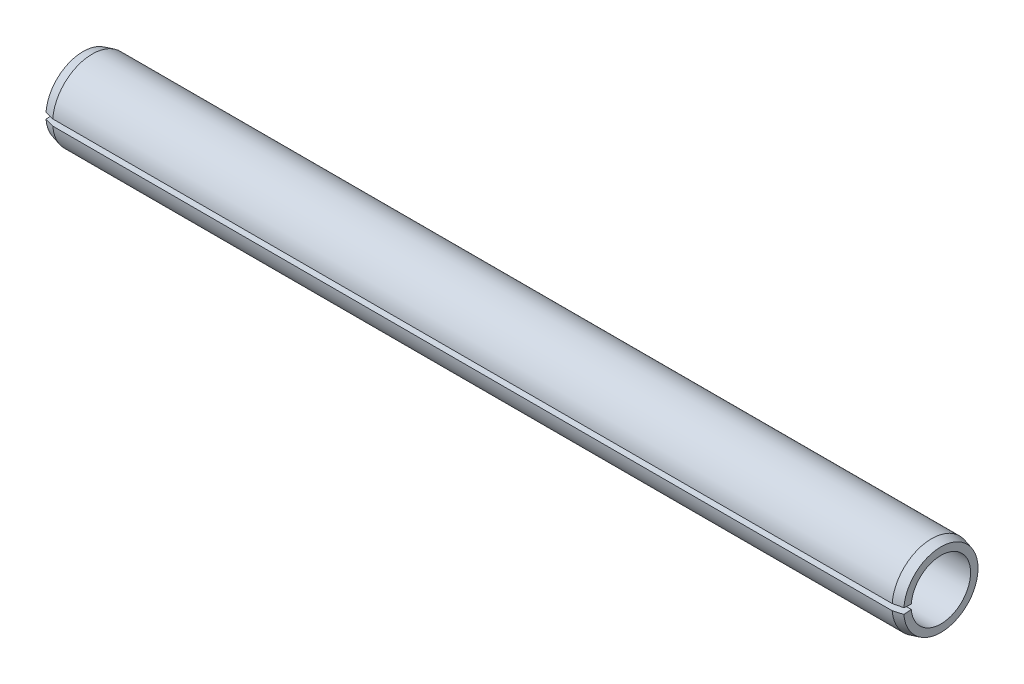
from build123d import *

# Parameters (mm, degrees)
GAP_DEPTH = 66.138314378


with BuildPart() as part:
    # Sketch1 → Base-Revolve (revolve)
    with BuildSketch(Plane.XY, mode=Mode.PRIVATE) as base_revolve_sk:
        Polygon((0, 2.25), (65, 2.25), (65, 2.8125), (64.3, 3), (0.7, 3), (0, 2.8125), align=None)
    revolve(base_revolve_sk.sketch.rotate(Axis((-9.525, 0, 0), (1, 0, 0)), 90), axis=Axis((-9.525, 0, 0), (1, 0, 0)))

    # Sketch2 → Gap (cut, through all)
    with BuildSketch(Plane(origin=(0, 0, 0), x_dir=(0, -1, 0), z_dir=(-1, 0, 0))):
        with BuildLine():
            Line((0, 0), (0.240084833, 3.050567041))
            ThreePointArc((0.240084833, 3.050567041), (0, 3.06), (-0.240084833, 3.050567041))
            Line((-0.240084833, 3.050567041), (0, 0))
        make_face()
    extrude(amount=-GAP_DEPTH, mode=Mode.SUBTRACT)


solid = part.part
